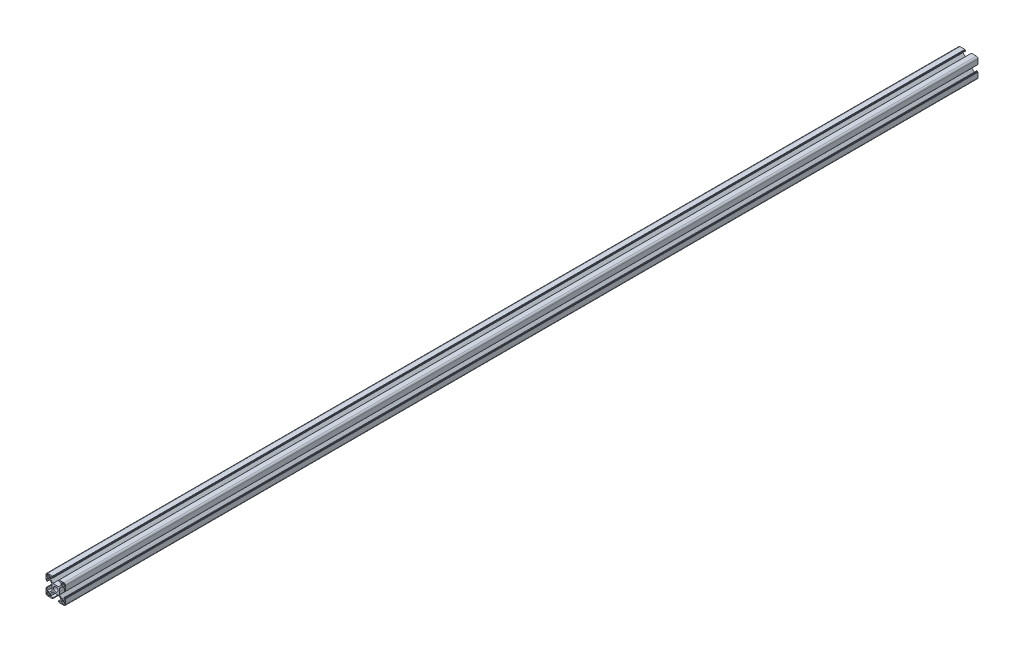
from build123d import *

# Parameters (mm, degrees)
SKETCH1_R      = 3.4
EXTRUDE1_DEPTH = 1400
EXTRUDE2_DEPTH = 1401.160705062


with BuildPart() as part:
    # Sketch1 → Extrude1 (new body)
    with BuildSketch(Plane.XY):
        with BuildLine():
            Line((-5.1, 14.2), (-5.1, 15))
            Line((-5.1, 15), (-12.5, 15))
            ThreePointArc((-12.5, 15), (-14.267766953, 14.267766953), (-15, 12.5))
            Line((-15, 12.5), (-15, 5.1))
            Line((-15, 5.1), (-14.2, 5.1))
            Line((-14.2, 5.1), (-14.2, 4.1))
            Line((-14.2, 4.1), (-13.2, 4.1))
            Line((-13.2, 4.1), (-13.2, 8.25))
            Line((-13.2, 8.25), (-9.522792206, 8.25))
            Line((-9.522792206, 8.25), (-5.7, 4.427207794))
            Line((-5.7, 4.427207794), (-5.7, -4.427207794))
            Line((-5.7, -4.427207794), (-9.522792206, -8.25))
            Line((-9.522792206, -8.25), (-13.2, -8.25))
            Line((-13.2, -8.25), (-13.2, -4.1))
            Line((-13.2, -4.1), (-14.2, -4.1))
            Line((-14.2, -4.1), (-14.2, -5.1))
            Line((-14.2, -5.1), (-15, -5.1))
            Line((-15, -5.1), (-15, -12.5))
            ThreePointArc((-15, -12.5), (-14.267766953, -14.267766953), (-12.5, -15))
            Line((-12.5, -15), (-5.1, -15))
            Line((-5.1, -15), (-5.1, -14.2))
            Line((-5.1, -14.2), (-4.1, -14.2))
            Line((-4.1, -14.2), (-4.1, -13.2))
            Line((-4.1, -13.2), (-8.25, -13.2))
            Line((-8.25, -13.2), (-8.25, -9.522792206))
            Line((-8.25, -9.522792206), (-4.427207794, -5.7))
            Line((-4.427207794, -5.7), (4.427207794, -5.7))
            Line((4.427207794, -5.7), (8.25, -9.522792206))
            Line((8.25, -9.522792206), (8.25, -13.2))
            Line((8.25, -13.2), (4.1, -13.2))
            Line((4.1, -13.2), (4.1, -14.2))
            Line((4.1, -14.2), (5.1, -14.2))
            Line((5.1, -14.2), (5.1, -15))
            Line((5.1, -15), (12.5, -15))
            ThreePointArc((12.5, -15), (14.267766953, -14.267766953), (15, -12.5))
            Line((15, -12.5), (15, -5.1))
            Line((15, -5.1), (14.2, -5.1))
            Line((14.2, -5.1), (14.2, -4.1))
            Line((14.2, -4.1), (13.2, -4.1))
            Line((13.2, -4.1), (13.2, -8.25))
            Line((13.2, -8.25), (9.522792206, -8.25))
            Line((9.522792206, -8.25), (5.7, -4.427207794))
            Line((5.7, -4.427207794), (5.7, 4.427207794))
            Line((5.7, 4.427207794), (9.522792206, 8.25))
            Line((9.522792206, 8.25), (13.2, 8.25))
            Line((13.2, 8.25), (13.2, 4.1))
            Line((13.2, 4.1), (14.2, 4.1))
            Line((14.2, 4.1), (14.2, 5.1))
            Line((14.2, 5.1), (15, 5.1))
            Line((15, 5.1), (15, 12.5))
            ThreePointArc((15, 12.5), (14.267766953, 14.267766953), (12.5, 15))
            Line((12.5, 15), (5.1, 15))
            Line((5.1, 15), (5.1, 14.2))
            Line((5.1, 14.2), (4.1, 14.2))
            Line((4.1, 14.2), (4.1, 13.2))
            Line((4.1, 13.2), (8.25, 13.2))
            Line((8.25, 13.2), (8.25, 9.522792206))
            Line((8.25, 9.522792206), (4.427207794, 5.7))
            Line((4.427207794, 5.7), (-4.427207794, 5.7))
            Line((-4.427207794, 5.7), (-8.25, 9.522792206))
            Line((-8.25, 9.522792206), (-8.25, 13.2))
            Line((-8.25, 13.2), (-4.1, 13.2))
            Line((-4.1, 13.2), (-4.1, 14.2))
            Line((-4.1, 14.2), (-5.1, 14.2))
        make_face()
        Circle(SKETCH1_R, mode=Mode.SUBTRACT)
    extrude(amount=EXTRUDE1_DEPTH)

    # Sketch2 → Extrude2 (cut, through all)
    with BuildSketch(Plane.XY.offset(1400)):
        with BuildLine():
            Line((13.7, 12.7), (13.7, 10.55))
            ThreePointArc((13.7, 10.55), (13.407106781, 9.842893219), (12.7, 9.55))
            Line((12.7, 9.55), (10.55, 9.55))
            ThreePointArc((10.55, 9.55), (9.842893219, 9.842893219), (9.55, 10.55))
            Line((9.55, 10.55), (9.55, 12.7))
            ThreePointArc((9.55, 12.7), (9.842893219, 13.407106781), (10.55, 13.7))
            Line((10.55, 13.7), (12.7, 13.7))
            ThreePointArc((12.7, 13.7), (13.407106781, 13.407106781), (13.7, 12.7))
        make_face()
        with BuildLine():
            Line((-12.7, 13.7), (-10.55, 13.7))
            ThreePointArc((-10.55, 13.7), (-9.842893219, 13.407106781), (-9.55, 12.7))
            Line((-9.55, 12.7), (-9.55, 10.55))
            ThreePointArc((-9.55, 10.55), (-9.842893219, 9.842893219), (-10.55, 9.55))
            Line((-10.55, 9.55), (-12.7, 9.55))
            ThreePointArc((-12.7, 9.55), (-13.407106781, 9.842893219), (-13.7, 10.55))
            Line((-13.7, 10.55), (-13.7, 12.7))
            ThreePointArc((-13.7, 12.7), (-13.407106781, 13.407106781), (-12.7, 13.7))
        make_face()
        with BuildLine():
            Line((12.7, -13.7), (10.55, -13.7))
            ThreePointArc((10.55, -13.7), (9.842893219, -13.407106781), (9.55, -12.7))
            Line((9.55, -12.7), (9.55, -10.55))
            ThreePointArc((9.55, -10.55), (9.842893219, -9.842893219), (10.55, -9.55))
            Line((10.55, -9.55), (12.7, -9.55))
            ThreePointArc((12.7, -9.55), (13.407106781, -9.842893219), (13.7, -10.55))
            Line((13.7, -10.55), (13.7, -12.7))
            ThreePointArc((13.7, -12.7), (13.407106781, -13.407106781), (12.7, -13.7))
        make_face()
        with BuildLine():
            Line((-13.7, -12.7), (-13.7, -10.55))
            ThreePointArc((-13.7, -10.55), (-13.407106781, -9.842893219), (-12.7, -9.55))
            Line((-12.7, -9.55), (-10.55, -9.55))
            ThreePointArc((-10.55, -9.55), (-9.842893219, -9.842893219), (-9.55, -10.55))
            Line((-9.55, -10.55), (-9.55, -12.7))
            ThreePointArc((-9.55, -12.7), (-9.842893219, -13.407106781), (-10.55, -13.7))
            Line((-10.55, -13.7), (-12.7, -13.7))
            ThreePointArc((-12.7, -13.7), (-13.407106781, -13.407106781), (-13.7, -12.7))
        make_face()
    extrude(amount=-EXTRUDE2_DEPTH, mode=Mode.SUBTRACT)


solid = part.part
